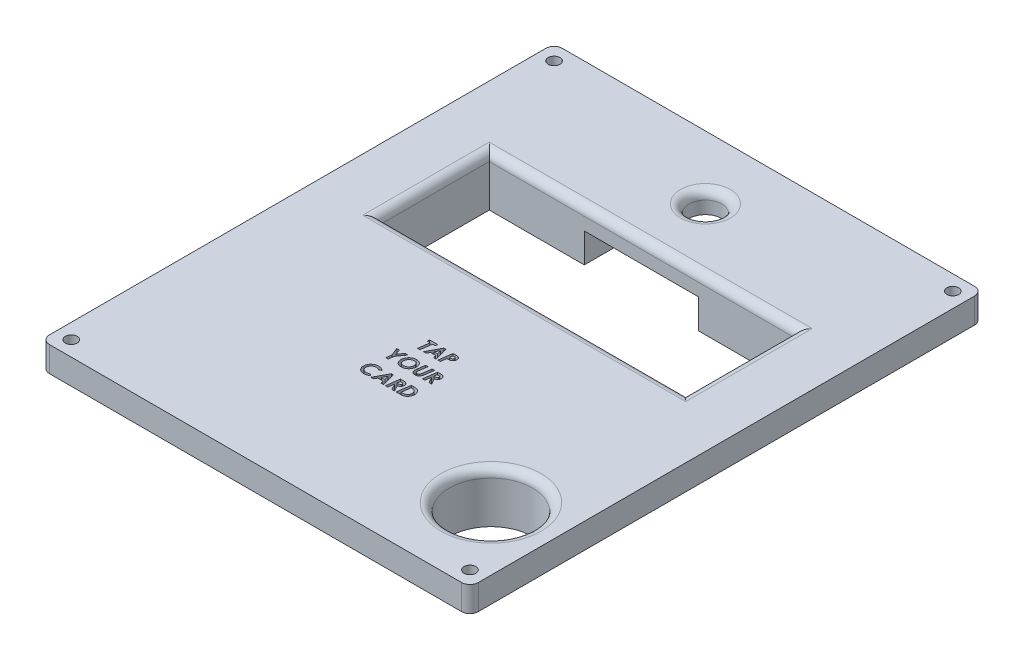
from build123d import *

# Parameters (mm, degrees)
BOSS_EXTRUDE1_DEPTH     = 6
SKETCH3_R               = 1.4
CUT_EXTRUDE1_DEPTH      = 151.691738327
MIRROR2_COPY_1_SKETCH_R = 1.4
MIRROR2_COPY_1_DEPTH    = 151.691738327
BOSS_EXTRUDE2_START     = -12
BOSS_EXTRUDE2_DEPTH     = 12
SKETCH5_R               = 3.9
SKETCH5_W               = 72.8
SKETCH5_H               = 26.1
CUT_EXTRUDE2_DEPTH      = 12
FILLET1_R               = 2
SKETCH6_W               = 39.3
SKETCH6_H               = 59.7
CUT_EXTRUDE3_DEPTH      = 10
CUT_EXTRUDE4_DEPTH      = 2
SKETCH8_R               = 9.9
CUT_EXTRUDE5_DEPTH      = 152.049660848
FILLET2_R               = 2
SKETCH10_W              = 27.2
SKETCH10_H              = 24
CUT_EXTRUDE6_DEPTH      = 7


with BuildPart() as part:
    # Sketch2 → Boss-Extrude1 (new body)
    with BuildSketch(Plane(origin=(0, 0, 0), x_dir=(1, 0, 0), z_dir=(0, 1, 0))):
        with BuildLine():
            Line((-94, 116), (4, 116))
            ThreePointArc((4, 116), (5.414213562, 115.414213562), (6, 114))
            Line((6, 114), (6, -4))
            ThreePointArc((6, -4), (5.414213562, -5.414213562), (4, -6))
            Line((4, -6), (-94, -6))
            ThreePointArc((-94, -6), (-95.414213562, -5.414213562), (-96, -4))
            Line((-96, -4), (-96, 114))
            ThreePointArc((-96, 114), (-95.414213562, 115.414213562), (-94, 116))
        make_face()
        with BuildLine():
            Line((-88, 110), (-2, 110))
            ThreePointArc((-2, 110), (-0.585786438, 109.414213562), (0, 108))
            Line((0, 108), (0, 2))
            ThreePointArc((0, 2), (-0.585786438, 0.585786438), (-2, 0))
            Line((-2, 0), (-88, 0))
            ThreePointArc((-88, 0), (-89.414213562, 0.585786438), (-90, 2))
            Line((-90, 2), (-90, 108))
            ThreePointArc((-90, 108), (-89.414213562, 109.414213562), (-88, 110))
        make_face(mode=Mode.SUBTRACT)
    extrude(amount=BOSS_EXTRUDE1_DEPTH)

    # Sketch3 → Cut-Extrude1 (cut, through all)
    with BuildSketch(Plane(origin=(0, 6, 0), x_dir=(1, 0, 0), z_dir=(0, 1, 0))):
        with Locations(Location((-92.414213562, 112.414213562, 0), (0, 0, 270))):
            Circle(SKETCH3_R)
    cut_extrude1 = extrude(amount=-CUT_EXTRUDE1_DEPTH, mode=Mode.SUBTRACT)

    # Mirror1: Cut-Extrude1 across plane
    add(cut_extrude1.mirror(Plane.ZY.offset(45)), mode=Mode.SUBTRACT)

    # Mirror2: Cut-Extrude1 across plane
    add(cut_extrude1.mirror(Plane.XY.offset(-55)), mode=Mode.SUBTRACT)

    # Mirror2 copy 1 sketch → Mirror2 copy 1 (cut, through all)
    with BuildSketch(Plane(origin=(-90, 6, -110), x_dir=(-1, 0, 0), z_dir=(0, 1, 0))):
        with Locations(Location((-92.414213562, 112.414213562, 0), (0, 0, 270))):
            Circle(MIRROR2_COPY_1_SKETCH_R)
    extrude(amount=-MIRROR2_COPY_1_DEPTH, mode=Mode.SUBTRACT)

    # Sketch4 → Boss-Extrude2 (add)
    with BuildSketch(Plane(origin=(0, 6, 0), x_dir=(1, 0, 0), z_dir=(0, 1, 0)).offset(BOSS_EXTRUDE2_START)):
        with BuildLine():
            Line((-88, 0), (-2, 0))
            ThreePointArc((-2, 0), (-0.585786438, 0.585786438), (0, 2))
            Line((0, 2), (0, 108))
            ThreePointArc((0, 108), (-0.585786438, 109.414213562), (-2, 110))
            Line((-2, 110), (-88, 110))
            ThreePointArc((-88, 110), (-89.414213562, 109.414213562), (-90, 108))
            Line((-90, 108), (-90, 2))
            ThreePointArc((-90, 2), (-89.414213562, 0.585786438), (-88, 0))
        make_face()
    extrude(amount=BOSS_EXTRUDE2_DEPTH)

    # Sketch5 → Cut-Extrude2 (cut)
    with BuildSketch(Plane(origin=(0, 6, 0), x_dir=(1, 0, 0), z_dir=(0, 1, 0))):
        with Locations(Location((-45, 101, 0), (0, 0, 270))):
            Circle(SKETCH5_R)
        with Locations((-45, 72.95)):
            Rectangle(SKETCH5_W, SKETCH5_H)
    extrude(amount=-CUT_EXTRUDE2_DEPTH, mode=Mode.SUBTRACT)

    # Fillet1
    fillet1_edges = [part.edges().sort_by_distance(p)[0] for p in [
        (-81.4, 6, -72.95),
        (-45, 6, -59.9),
        (-8.6, 6, -72.95),
        (-45, 6, -86),
        (-45, 6, -104.9),
    ]]
    fillet(fillet1_edges, radius=FILLET1_R)

    # Sketch6 → Cut-Extrude3 (cut)
    with BuildSketch(Plane.XZ.offset(6)):
        with Locations((-49.6, -25.05)):
            Rectangle(SKETCH6_W, SKETCH6_H)
    extrude(amount=-CUT_EXTRUDE3_DEPTH, mode=Mode.SUBTRACT)

    # Sketch7 → Cut-Extrude4 (cut)
    # profile 1 of 11: a face of its own
    with BuildSketch(Plane(origin=(0, 6, 0), x_dir=(1, 0, 0), z_dir=(0, 1, 0))):
        Polygon((-49.744871795, 40.167830978), (-47.831730769, 40.167830978), (-47.900420673, 39.638664311), (-48.51799379, 39.638664311), (-48.885611979, 36.992830978), (-49.459935897, 36.992830978), (-49.093589744, 39.638664311), (-49.818013822, 39.638664311), align=None)
    # profile 2 of 11: a face of its own
    with BuildSketch(Plane(origin=(0, 6, 0), x_dir=(1, 0, 0), z_dir=(0, 1, 0))):
        Polygon((-46.369526242, 40.167830978), (-45.869616386, 40.167830978), (-45.063782051, 36.992830978), (-45.649554287, 36.992830978), (-45.825095152, 37.684818157), (-47.063421474, 37.684818157), (-47.434855769, 36.992830978), (-48.075961538, 36.992830978), align=None)
        Polygon((-45.960566907, 38.213984824), (-46.221970152, 39.248785505), (-46.779121595, 38.213984824), align=None, mode=Mode.SUBTRACT)
    # profile 3 of 11: a face of its own
    with BuildSketch(Plane(origin=(0, 6, 0), x_dir=(1, 0, 0), z_dir=(0, 1, 0))):
        with BuildLine():
            Line((-44.170813301, 40.167830978), (-43.627654247, 40.167830978))
            add(Edge.make_bspline(
                [(-43.627654247, 40.167830978), (-43.588003731, 40.167669491), (-43.511643271, 40.167358494), (-43.401577566, 40.162696225), (-43.300384916, 40.1559322), (-43.208315119, 40.146459396), (-43.125386587, 40.134927505), (-43.051842161, 40.119271683), (-42.9867555, 40.102579063), (-42.947621545, 40.086806208), (-42.929306891, 40.079424527)],
                knots=[0, 0, 0, 0, 1.344208059, 2.588726621, 3.734329264, 4.782131975, 5.726482068, 6.570895881, 7.331180631, 8, 8, 8, 8], degree=3))
            add(Edge.make_bspline(
                [(-42.929306891, 40.079424527), (-42.908811052, 40.070176556), (-42.868412322, 40.051948158), (-42.811332777, 40.020061667), (-42.758192981, 39.985375635), (-42.708493733, 39.948656416), (-42.662598682, 39.909097892), (-42.620240816, 39.867018474), (-42.582177394, 39.821734815), (-42.547655113, 39.773940292), (-42.51727933, 39.723626424), (-42.490290294, 39.671516983), (-42.468203937, 39.617105571), (-42.449383565, 39.56093108), (-42.435607577, 39.50211203), (-42.425618819, 39.441336652), (-42.418806519, 39.378474335), (-42.418237992, 39.335938259), (-42.417948718, 39.31429532)],
                knots=[0, 0, 0, 0, 1.101151138, 2.170445781, 3.198860437, 4.208379212, 5.195204417, 6.164605257, 7.130047863, 8.089887807, 9.049952485, 10.006809717, 10.961522665, 11.923831799, 12.906274987, 13.917075149, 14.940179313, 16, 16, 16, 16], degree=3))
            add(Edge.make_bspline(
                [(-42.417948718, 39.31429532), (-42.418492495, 39.290535582), (-42.41957266, 39.243338941), (-42.426519046, 39.173576447), (-42.438659602, 39.10552824), (-42.456102364, 39.039333232), (-42.477423521, 38.97429861), (-42.504462941, 38.911350336), (-42.535501097, 38.849902122), (-42.57198103, 38.791156201), (-42.611468492, 38.734543971), (-42.655714869, 38.682353231), (-42.702866342, 38.634117297), (-42.752674256, 38.588780239), (-42.806817285, 38.548688545), (-42.863398049, 38.511321495), (-42.92375898, 38.478892582), (-42.98817048, 38.449671569), (-43.060103954, 38.424476957), (-43.141321185, 38.402578531), (-43.233503406, 38.383576494), (-43.336284207, 38.368057196), (-43.450005144, 38.355342806), (-43.574347926, 38.346299588), (-43.709625681, 38.338982588), (-43.803396961, 38.337086424), (-43.85216847, 38.336100208)],
                knots=[0, 0, 0, 0, 0.866399648, 1.721027061, 2.553550129, 3.384204618, 4.21539855, 5.04677222, 5.880012857, 6.723270778, 7.566245156, 8.394738354, 9.214784533, 10.025005932, 10.847562629, 11.668810448, 12.495570546, 13.343317016, 14.245569203, 15.271435576, 16.408570332, 17.675782105, 19.060520395, 20.580184572, 22.221315141, 24, 24, 24, 24], degree=3))
            Line((-43.85216847, 38.336100208), (-44.041065705, 36.992830978))
            Line((-44.041065705, 36.992830978), (-44.616025641, 36.992830978))
            Line((-44.616025641, 36.992830978), (-44.170813301, 40.167830978))
        make_face()
        with BuildLine():
            add(Edge.make_bspline(
                [(-43.779026442, 38.865266875), (-43.739802006, 38.865936707), (-43.664925512, 38.867215365), (-43.557955927, 38.871827253), (-43.461831998, 38.880723593), (-43.376230756, 38.89255532), (-43.301180944, 38.907563679), (-43.23636571, 38.925406542), (-43.182653026, 38.947615082), (-43.138184739, 38.972661293), (-43.102896166, 39.002480711), (-43.071620081, 39.033740275), (-43.045468348, 39.06885978), (-43.024454299, 39.107523709), (-43.007647809, 39.149063358), (-42.996412839, 39.194244166), (-42.989345201, 39.242414658), (-42.988335836, 39.27568487), (-42.987820513, 39.292670721)],
                knots=[0, 0, 0, 0, 1.838765686, 3.510065221, 5.016980247, 6.361850363, 7.558417778, 8.602601797, 9.506864385, 10.2772185, 10.983371583, 11.664976924, 12.346654695, 13.027100102, 13.722757683, 14.440973152, 15.204050804, 16, 16, 16, 16], degree=3))
            add(Edge.make_bspline(
                [(-42.987820513, 39.292670721), (-42.988592238, 39.311581901), (-42.990096939, 39.348454707), (-43.000602832, 39.401468676), (-43.019738466, 39.449545831), (-43.044913924, 39.493144809), (-43.077999739, 39.531221521), (-43.117960592, 39.563451226), (-43.165213728, 39.588996015), (-43.210161851, 39.604740972), (-43.251923706, 39.614790825), (-43.291101841, 39.620742948), (-43.337098335, 39.626555841), (-43.390175289, 39.630660966), (-43.449947457, 39.634654903), (-43.51696927, 39.637073476), (-43.590973441, 39.638156591), (-43.642706344, 39.638490516), (-43.66963141, 39.638664311)],
                knots=[0, 0, 0, 0, 1.03742853, 2.022766538, 2.947121861, 3.864647693, 4.771646501, 5.697975149, 6.666071958, 7.703435297, 8.301453266, 9.020359131, 9.87578453, 10.844509861, 11.939964187, 13.162010635, 14.522931311, 16, 16, 16, 16], degree=3))
            Line((-43.66963141, 39.638664311), (-43.779026442, 38.865266875))
        make_face(mode=Mode.SUBTRACT)
    # profile 4 of 11: a face of its own
    with BuildSketch(Plane(origin=(0, 6, 0), x_dir=(1, 0, 0), z_dir=(0, 1, 0))):
        Polygon((-51.881891026, 34.47643421), (-51.275130208, 34.47643421), (-50.789848758, 33.221571429), (-49.886703726, 34.47643421), (-49.197896635, 34.47643421), (-50.571058694, 32.56710929), (-50.737695313, 31.30143421), (-51.312019231, 31.30143421), (-51.144746595, 32.570289378), align=None)
    # profile 5 of 11: a face of its own
    with BuildSketch(Plane(origin=(0, 6, 0), x_dir=(1, 0, 0), z_dir=(0, 1, 0))):
        with BuildLine():
            add(Edge.make_bspline(
                [(-47.244686498, 34.557844466), (-47.191196979, 34.556721875), (-47.086171897, 34.554517702), (-46.932227555, 34.534233966), (-46.785361577, 34.501540777), (-46.645931798, 34.454659521), (-46.513402874, 34.395433309), (-46.388093707, 34.32244456), (-46.270141125, 34.236208422), (-46.160505538, 34.137893369), (-46.061196568, 34.029567841), (-45.973130411, 33.913625721), (-45.899992421, 33.789539635), (-45.839761282, 33.658691319), (-45.792281391, 33.520937702), (-45.759893277, 33.375616805), (-45.73851455, 33.223691534), (-45.736461961, 33.119883865), (-45.735416667, 33.067019146)],
                knots=[0, 0, 0, 0, 1.079937363, 2.120424901, 3.130164457, 4.114608815, 5.086352068, 6.057283592, 7.037967613, 8.032612779, 9.026667848, 10.002130715, 10.967845321, 11.92966918, 12.907375778, 13.904589319, 14.932898699, 16, 16, 16, 16], degree=3))
            add(Edge.make_bspline(
                [(-45.735416667, 33.067019146), (-45.73608611, 33.025859156), (-45.73741758, 32.943995127), (-45.75008715, 32.822271597), (-45.769824627, 32.70227551), (-45.796849929, 32.583972233), (-45.833025979, 32.467741203), (-45.876208608, 32.352893762), (-45.927723864, 32.239899797), (-45.986886361, 32.129634513), (-46.05169752, 32.023396747), (-46.122734518, 31.922941061), (-46.19904989, 31.828863643), (-46.280350747, 31.740794117), (-46.367514976, 31.659911505), (-46.458838916, 31.584521381), (-46.556300939, 31.516337379), (-46.658353836, 31.45405691), (-46.765210895, 31.39870617), (-46.876150059, 31.350866074), (-46.991026942, 31.310867384), (-47.109570295, 31.277798917), (-47.232072916, 31.251490989), (-47.358512122, 31.233317473), (-47.488932268, 31.222288157), (-47.57708995, 31.220786367), (-47.621844952, 31.220023953)],
                knots=[0, 0, 0, 0, 1.005311864, 1.999487392, 2.986390894, 3.975195422, 4.961487101, 5.958115224, 6.97104375, 7.992937587, 9.013623077, 10.009524137, 10.996414046, 11.971324635, 12.935123389, 13.899409138, 14.862205298, 15.838449601, 16.81836937, 17.799766407, 18.787539403, 19.787875373, 20.804768927, 21.846385261, 22.906674593, 24, 24, 24, 24], degree=3))
            add(Edge.make_bspline(
                [(-47.621844952, 31.220023953), (-47.677239204, 31.22116552), (-47.785402904, 31.223394563), (-47.943044096, 31.243081381), (-48.092195911, 31.273819296), (-48.232865224, 31.317822927), (-48.365314087, 31.374564887), (-48.489105416, 31.444189465), (-48.604542317, 31.52593755), (-48.709689641, 31.620388584), (-48.805300712, 31.723992505), (-48.887402827, 31.837610786), (-48.958302843, 31.958176047), (-49.014551897, 32.087663828), (-49.059561116, 32.224485132), (-49.090919684, 32.369427024), (-49.110530038, 32.52226143), (-49.112787604, 32.626833637), (-49.113942308, 32.680320428)],
                knots=[0, 0, 0, 0, 1.129126937, 2.20475128, 3.23403939, 4.230775744, 5.204839333, 6.16680792, 7.121629951, 8.083044708, 9.04383724, 9.990659777, 10.936010704, 11.890255174, 12.863608629, 13.868449271, 14.909750384, 16, 16, 16, 16], degree=3))
            add(Edge.make_bspline(
                [(-49.113942308, 32.680320428), (-49.112555013, 32.741458342), (-49.109823355, 32.861842165), (-49.085810573, 33.039045807), (-49.049106391, 33.210095252), (-48.995024519, 33.374081643), (-48.926819765, 33.531627242), (-48.842813448, 33.682207503), (-48.744307202, 33.827043464), (-48.667508954, 33.91617373), (-48.628660857, 33.961259931)],
                knots=[0, 0, 0, 0, 1.045740506, 2.05911896, 3.05467723, 4.035585325, 5.008815224, 5.988058098, 6.982266978, 8, 8, 8, 8], degree=3))
            add(Edge.make_bspline(
                [(-48.628660857, 33.961259931), (-48.606046182, 33.985705352), (-48.561224003, 34.034156061), (-48.489488885, 34.10148706), (-48.415997743, 34.16452525), (-48.339710326, 34.222522289), (-48.261778799, 34.276825204), (-48.180961323, 34.325722499), (-48.097563609, 34.369744769), (-48.012492688, 34.409887349), (-47.924284817, 34.444162991), (-47.834464712, 34.474873987), (-47.741785886, 34.500213426), (-47.646901524, 34.521186358), (-47.549720798, 34.537862595), (-47.450114594, 34.549054459), (-47.348252367, 34.556297115), (-47.279467901, 34.557324806), (-47.244686498, 34.557844466)],
                knots=[0, 0, 0, 0, 1.027812829, 2.037120149, 3.035266778, 4.015768311, 4.994345575, 5.966422343, 6.929711672, 7.904780536, 8.86860337, 9.849672715, 10.834163809, 11.833018336, 12.848777673, 13.876590502, 14.926281379, 16, 16, 16, 16], degree=3))
        make_face()
        with BuildLine():
            add(Edge.make_bspline(
                [(-47.258042869, 34.028677799), (-47.286896372, 34.028246445), (-47.344300191, 34.027388268), (-47.429264569, 34.018758039), (-47.512519674, 34.005386229), (-47.593715694, 33.987060934), (-47.673242188, 33.963410157), (-47.750557711, 33.934182291), (-47.826233504, 33.899592248), (-47.89943525, 33.859678997), (-47.970408513, 33.815170174), (-48.037671268, 33.765497608), (-48.101696498, 33.711372383), (-48.161406544, 33.651840232), (-48.218112604, 33.588124384), (-48.27165594, 33.520096146), (-48.321367812, 33.447092948), (-48.36746933, 33.370329119), (-48.408392792, 33.290434225), (-48.444741926, 33.209866332), (-48.475677396, 33.128613971), (-48.500211059, 33.046456219), (-48.520238702, 32.963722429), (-48.534126033, 32.880194623), (-48.542748675, 32.79604772), (-48.543629434, 32.739702565), (-48.544070513, 32.711485291)],
                knots=[0, 0, 0, 0, 1.015557909, 2.02044445, 3.003357477, 3.982977463, 4.948851735, 5.922052592, 6.890662853, 7.875953625, 8.855459861, 9.837777552, 10.817397539, 11.804383193, 12.803598646, 13.818964529, 14.849984807, 15.911175445, 16.969421976, 18.008462528, 19.021851172, 20.027762868, 21.025304218, 22.016795393, 23.006824523, 24, 24, 24, 24], degree=3))
            add(Edge.make_bspline(
                [(-48.544070513, 32.711485291), (-48.543374171, 32.678587178), (-48.54200408, 32.613858339), (-48.530065338, 32.518573525), (-48.511567419, 32.426837155), (-48.483576051, 32.339409534), (-48.449564044, 32.255345375), (-48.406380436, 32.17590108), (-48.356738683, 32.099505776), (-48.299042587, 32.028100003), (-48.23459929, 31.962173323), (-48.161896082, 31.905295646), (-48.082782872, 31.856729013), (-47.996919879, 31.817208663), (-47.904377848, 31.786363113), (-47.804918806, 31.765402914), (-47.698980394, 31.751513452), (-47.626131459, 31.749978035), (-47.588772035, 31.74919062)],
                knots=[0, 0, 0, 0, 1.032572517, 2.031642993, 3.01079972, 3.966643664, 4.909863955, 5.853952978, 6.801111379, 7.766917104, 8.731873648, 9.689385086, 10.65752794, 11.640388645, 12.650815691, 13.713650281, 14.827481725, 16, 16, 16, 16], degree=3))
            add(Edge.make_bspline(
                [(-47.588772035, 31.74919062), (-47.545039536, 31.750223897), (-47.458685115, 31.752264211), (-47.331845611, 31.770436659), (-47.210085475, 31.800603636), (-47.093394254, 31.84182719), (-46.981734357, 31.895182915), (-46.875103014, 31.960302469), (-46.773775358, 32.037807054), (-46.678566499, 32.125669408), (-46.591105771, 32.221568716), (-46.514653299, 32.324059714), (-46.449726867, 32.431793034), (-46.396829312, 32.544533095), (-46.355900663, 32.66246966), (-46.3267241, 32.785395522), (-46.308311971, 32.913393261), (-46.306304847, 33.000598651), (-46.305288462, 33.044758529)],
                knots=[0, 0, 0, 0, 1.03369803, 2.041145535, 3.022357397, 3.995919545, 4.96236968, 5.943376615, 6.945032455, 7.973917545, 9.003120129, 10.009769043, 10.992465341, 11.972511115, 12.949140339, 13.93890809, 14.956285095, 16, 16, 16, 16], degree=3))
            add(Edge.make_bspline(
                [(-46.305288462, 33.044758529), (-46.305874813, 33.081053561), (-46.30702393, 33.152183634), (-46.320292031, 33.255760509), (-46.34044674, 33.353933533), (-46.368778918, 33.446672364), (-46.406940193, 33.533455263), (-46.451710004, 33.615350517), (-46.50592969, 33.690968752), (-46.567372534, 33.760559978), (-46.635302763, 33.82379367), (-46.709398367, 33.878314277), (-46.788048145, 33.925651199), (-46.872597241, 33.962581305), (-46.961515751, 33.993212477), (-47.055851733, 34.013805984), (-47.155324279, 34.025967478), (-47.223238699, 34.02775946), (-47.258042869, 34.028677799)],
                knots=[0, 0, 0, 0, 1.12845219, 2.211511647, 3.242392028, 4.243671568, 5.221368115, 6.186708094, 7.141970352, 8.109200861, 9.070590294, 10.022934043, 10.966237583, 11.91979086, 12.887493425, 13.887534174, 14.917422563, 16, 16, 16, 16], degree=3))
        make_face(mode=Mode.SUBTRACT)
    # profile 6 of 11: a face of its own
    with BuildSketch(Plane(origin=(0, 6, 0), x_dir=(1, 0, 0), z_dir=(0, 1, 0))):
        with BuildLine():
            Line((-45.004632412, 34.47643421), (-44.428400441, 34.47643421))
            Line((-44.428400441, 34.47643421), (-44.703796074, 32.512411774))
            add(Edge.make_bspline(
                [(-44.703796074, 32.512411774), (-44.706596873, 32.491216889), (-44.711971105, 32.450547694), (-44.719007147, 32.391822494), (-44.724772811, 32.337971593), (-44.729119644, 32.288964672), (-44.732857523, 32.244864924), (-44.736529263, 32.205695156), (-44.737514829, 32.171086436), (-44.737942199, 32.14966936), (-44.738141026, 32.139705444)],
                knots=[0, 0, 0, 0, 1.370131483, 2.629037392, 3.790386942, 4.840899086, 5.781938864, 6.627066857, 7.36126714, 8, 8, 8, 8], degree=3))
            add(Edge.make_bspline(
                [(-44.738141026, 32.139705444), (-44.736926513, 32.110529019), (-44.734603717, 32.054728155), (-44.71341435, 31.975763733), (-44.676993544, 31.907504597), (-44.627019426, 31.849355016), (-44.56285635, 31.803700186), (-44.485385481, 31.772041022), (-44.395906974, 31.752058977), (-44.331842911, 31.750181785), (-44.298016827, 31.74919062)],
                knots=[0, 0, 0, 0, 1.045914474, 2.000345514, 2.905926209, 3.80150764, 4.72860727, 5.703865586, 6.787631738, 8, 8, 8, 8], degree=3))
            add(Edge.make_bspline(
                [(-44.298016827, 31.74919062), (-44.269961015, 31.750161326), (-44.2151493, 31.752057762), (-44.136035406, 31.767004768), (-44.062074355, 31.790828756), (-44.017436572, 31.814854963), (-43.995272436, 31.826784771)],
                knots=[0, 0, 0, 0, 1.064247791, 2.079185811, 3.046252183, 4, 4, 4, 4], degree=3))
            add(Edge.make_bspline(
                [(-43.995272436, 31.826784771), (-43.979603394, 31.837518516), (-43.947573861, 31.859459669), (-43.905764129, 31.903260093), (-43.869816266, 31.956649965), (-43.843742965, 32.008432477), (-43.824805476, 32.057416133), (-43.810201622, 32.103248222), (-43.796777812, 32.157609321), (-43.78173327, 32.219768815), (-43.768309757, 32.290342835), (-43.753895279, 32.368900004), (-43.741095055, 32.455991726), (-43.732170996, 32.516864488), (-43.727509014, 32.548664779)],
                knots=[0, 0, 0, 0, 0.859785812, 1.75751252, 2.725816041, 3.770921983, 4.379908327, 5.106796295, 5.951169398, 6.919234109, 8.007475297, 9.209126838, 10.542031388, 12, 12, 12, 12], degree=3))
            Line((-43.727509014, 32.548664779), (-43.458473558, 34.47643421))
            Line((-43.458473558, 34.47643421), (-42.882877604, 34.47643421))
            Line((-42.882877604, 34.47643421), (-43.148096955, 32.577285572))
            add(Edge.make_bspline(
                [(-43.148096955, 32.577285572), (-43.154632656, 32.530394586), (-43.167283984, 32.439626462), (-43.189609775, 32.309029926), (-43.212999077, 32.188756251), (-43.237613547, 32.078772293), (-43.264351809, 31.979118262), (-43.291776784, 31.889282706), (-43.321777122, 31.810154068), (-43.353151554, 31.740102521), (-43.387611137, 31.677429631), (-43.424496188, 31.619224324), (-43.46503423, 31.56492109), (-43.510379535, 31.515374735), (-43.557515254, 31.467900731), (-43.609533034, 31.425268602), (-43.664892535, 31.38648715), (-43.723602696, 31.35151097), (-43.785440576, 31.31994682), (-43.851022342, 31.29376169), (-43.919420061, 31.270316946), (-43.99142663, 31.252334718), (-44.066520434, 31.237418037), (-44.145170247, 31.22761266), (-44.226877531, 31.220902848), (-44.282526184, 31.22031962), (-44.310737179, 31.220023953)],
                knots=[0, 0, 0, 0, 1.68937953, 3.270176719, 4.727170616, 6.061442758, 7.290970074, 8.408416811, 9.411646792, 10.308867284, 11.145104278, 11.961496883, 12.766452085, 13.559335946, 14.356431464, 15.151693874, 15.955546226, 16.76645207, 17.588608135, 18.430132747, 19.284214091, 20.166802823, 21.07631458, 22.014693117, 22.993551838, 24, 24, 24, 24], degree=3))
            add(Edge.make_bspline(
                [(-44.310737179, 31.220023953), (-44.348721112, 31.220660692), (-44.422772643, 31.221902045), (-44.530390828, 31.234299992), (-44.63166764, 31.25393006), (-44.7265305, 31.281027375), (-44.815263869, 31.316215294), (-44.897423215, 31.359408056), (-44.973239457, 31.410707478), (-45.042012932, 31.469809413), (-45.102741464, 31.536291898), (-45.157161513, 31.607609804), (-45.201434274, 31.68608957), (-45.238495213, 31.769515859), (-45.267401221, 31.858818475), (-45.287177766, 31.953938401), (-45.300608093, 32.054733722), (-45.301719565, 32.123971005), (-45.302288662, 32.15942199)],
                knots=[0, 0, 0, 0, 1.176817036, 2.294262238, 3.35222762, 4.371216899, 5.347337327, 6.305512179, 7.242247007, 8.178728305, 9.108709636, 10.028608558, 10.952815287, 11.894170772, 12.854168769, 13.85552807, 14.901984008, 16, 16, 16, 16], degree=3))
            add(Edge.make_bspline(
                [(-45.302288662, 32.15942199), (-45.30220213, 32.17617383), (-45.302019117, 32.211603719), (-45.299077697, 32.26735698), (-45.295419221, 32.328868985), (-45.289655304, 32.395879366), (-45.281794641, 32.468558061), (-45.272873267, 32.546787241), (-45.26287505, 32.630795349), (-45.254895788, 32.688601138), (-45.250771234, 32.718481485)],
                knots=[0, 0, 0, 0, 0.71553134, 1.513337966, 2.384471215, 3.347928436, 4.386088841, 5.507247356, 6.711473103, 8, 8, 8, 8], degree=3))
            Line((-45.250771234, 32.718481485), (-45.004632412, 34.47643421))
        make_face()
    # profile 7 of 11: a face of its own
    with BuildSketch(Plane(origin=(0, 6, 0), x_dir=(1, 0, 0), z_dir=(0, 1, 0))):
        with BuildLine():
            Line((-42.155909455, 34.47643421), (-41.604482171, 34.47643421))
            add(Edge.make_bspline(
                [(-41.604482171, 34.47643421), (-41.563560306, 34.47626698), (-41.484658029, 34.47594454), (-41.371193989, 34.471359453), (-41.267053302, 34.46444197), (-41.172359798, 34.45531298), (-41.087034416, 34.442647018), (-41.011254597, 34.427438992), (-40.944536317, 34.410502737), (-40.9045256, 34.394764464), (-40.885782252, 34.387391742)],
                knots=[0, 0, 0, 0, 1.348808202, 2.600664361, 3.742342956, 4.788858012, 5.735658768, 6.584006912, 7.336666444, 8, 8, 8, 8], degree=3))
            add(Edge.make_bspline(
                [(-40.885782252, 34.387391742), (-40.864679652, 34.377875477), (-40.823427409, 34.359272687), (-40.76431535, 34.327739814), (-40.708961508, 34.293770353), (-40.658283273, 34.256083543), (-40.611211177, 34.216266254), (-40.568037111, 34.173939771), (-40.529108716, 34.128454514), (-40.494017446, 34.08062632), (-40.462814441, 34.030517049), (-40.436029875, 33.977879599), (-40.412869725, 33.92315961), (-40.394783568, 33.865761635), (-40.379751797, 33.806374671), (-40.370029793, 33.744624028), (-40.363187905, 33.680718), (-40.362625712, 33.63733416), (-40.362339744, 33.615266341)],
                knots=[0, 0, 0, 0, 1.116361014, 2.182309107, 3.229450697, 4.24598407, 5.225421932, 6.201651319, 7.158895679, 8.110002388, 9.060669178, 10.002827475, 10.956240434, 11.923213192, 12.902917952, 13.908279153, 14.936015885, 16, 16, 16, 16], degree=3))
            add(Edge.make_bspline(
                [(-40.362339744, 33.615266341), (-40.363012268, 33.588110371), (-40.364339941, 33.53450009), (-40.373015234, 33.455444519), (-40.389195734, 33.379582491), (-40.410985987, 33.306675034), (-40.437982361, 33.236250081), (-40.472797718, 33.169533078), (-40.513039941, 33.105361562), (-40.559515601, 33.044576865), (-40.611463341, 32.986621385), (-40.671444781, 32.934905867), (-40.736141662, 32.885952295), (-40.808211823, 32.843042792), (-40.885673157, 32.803183684), (-40.970292447, 32.769412626), (-41.060481522, 32.738247151), (-41.123720457, 32.722649265), (-41.156089744, 32.71466538)],
                knots=[0, 0, 0, 0, 0.995453645, 1.965186658, 2.910129054, 3.83459069, 4.752398018, 5.669942118, 6.588407184, 7.525617038, 8.471772905, 9.435289717, 10.423772802, 11.441988612, 12.505459691, 13.613754905, 14.778583949, 16, 16, 16, 16], degree=3))
            Line((-41.156089744, 32.71466538), (-40.423397436, 31.30143421))
            Line((-40.423397436, 31.30143421), (-41.060051082, 31.30143421))
            Line((-41.060051082, 31.30143421), (-41.777478966, 32.685408569))
            Line((-41.777478966, 32.685408569), (-41.830904447, 32.685408569))
            Line((-41.830904447, 32.685408569), (-42.026161859, 31.30143421))
            Line((-42.026161859, 31.30143421), (-42.601121795, 31.30143421))
            Line((-42.601121795, 31.30143421), (-42.155909455, 34.47643421))
        make_face()
        with BuildLine():
            add(Edge.make_bspline(
                [(-41.756490385, 33.214575235), (-41.715567143, 33.214954077), (-41.637291277, 33.215678705), (-41.525500155, 33.22074926), (-41.424892208, 33.228670266), (-41.335579467, 33.240194676), (-41.257280767, 33.25362843), (-41.190149173, 33.270484449), (-41.134079143, 33.290517557), (-41.088187434, 33.3142766), (-41.051011954, 33.342171657), (-41.018834986, 33.371940135), (-40.99204187, 33.405262629), (-40.969935149, 33.441579749), (-40.952884963, 33.480966763), (-40.940589143, 33.523690514), (-40.933790686, 33.569466136), (-40.932745569, 33.601040585), (-40.932211538, 33.617174394)],
                knots=[0, 0, 0, 0, 1.89335902, 3.621519463, 5.176573087, 6.561132097, 7.786781855, 8.850229336, 9.759505088, 10.53614971, 11.230649399, 11.903761734, 12.55942339, 13.202041648, 13.865362736, 14.539046595, 15.253486819, 16, 16, 16, 16], degree=3))
            add(Edge.make_bspline(
                [(-40.932211538, 33.617174394), (-40.93290282, 33.635467803), (-40.934243812, 33.670954508), (-40.945842843, 33.722065605), (-40.96567679, 33.768430285), (-40.993550684, 33.809605407), (-41.028335864, 33.845911227), (-41.070771648, 33.87581467), (-41.120374235, 33.899348783), (-41.166836881, 33.914916799), (-41.210619241, 33.923841646), (-41.25159084, 33.930085053), (-41.300158323, 33.935739601), (-41.356380083, 33.940113849), (-41.420020531, 33.942995891), (-41.491249698, 33.945751852), (-41.570134923, 33.946742499), (-41.625258889, 33.947087231), (-41.654091546, 33.947267543)],
                knots=[0, 0, 0, 0, 0.975025327, 1.891415476, 2.778007847, 3.650053007, 4.529910843, 5.446300992, 6.402314795, 7.450247022, 8.051382379, 8.78400578, 9.660805258, 10.659230114, 11.791644133, 13.059173022, 14.461796856, 16, 16, 16, 16], degree=3))
            Line((-41.654091546, 33.947267543), (-41.756490385, 33.214575235))
        make_face(mode=Mode.SUBTRACT)
    # profile 8 of 11: a face of its own
    with BuildSketch(Plane(origin=(0, 6, 0), x_dir=(1, 0, 0), z_dir=(0, 1, 0))):
        with BuildLine():
            Line((-49.168639824, 28.239685121), (-49.608128005, 27.845990209))
            add(Edge.make_bspline(
                [(-49.608128005, 27.845990209), (-49.632517126, 27.872712556), (-49.681199479, 27.926052189), (-49.765552068, 27.99454867), (-49.85694532, 28.054168022), (-49.955794001, 28.103664866), (-50.060601729, 28.143197835), (-50.170468877, 28.171054051), (-50.284743216, 28.188060584), (-50.362385682, 28.190239493), (-50.401878005, 28.191347781)],
                knots=[0, 0, 0, 0, 0.971056601, 1.938295404, 2.910103745, 3.898650509, 4.902833105, 5.914277838, 6.939111328, 8, 8, 8, 8], degree=3))
            add(Edge.make_bspline(
                [(-50.401878005, 28.191347781), (-50.429882967, 28.190908964), (-50.485593417, 28.190036023), (-50.568695727, 28.18145018), (-50.650854893, 28.167341941), (-50.732204699, 28.14824734), (-50.812941216, 28.124223699), (-50.892182236, 28.09341422), (-50.97066619, 28.057581546), (-51.048026155, 28.017286565), (-51.122368793, 27.971682134), (-51.193132923, 27.922697551), (-51.259640616, 27.87049545), (-51.32155307, 27.814232698), (-51.379259635, 27.754298711), (-51.433807073, 27.691624923), (-51.482473232, 27.624266628), (-51.527805052, 27.554719692), (-51.567642905, 27.48228177), (-51.602458526, 27.408504725), (-51.63319782, 27.333914926), (-51.655873386, 27.257347772), (-51.675787609, 27.180103138), (-51.68855588, 27.101324143), (-51.697474491, 27.02149251), (-51.698301947, 26.967887107), (-51.698717949, 26.940937124)],
                knots=[0, 0, 0, 0, 1.01063672, 2.010466049, 3.011934156, 4.018040672, 5.025194429, 6.049901815, 7.084166442, 8.138480354, 9.196343408, 10.230183256, 11.243713301, 12.245999792, 13.247233952, 14.245803109, 15.242258641, 16.244194478, 17.240973215, 18.223430354, 19.188354289, 20.149355445, 21.103383867, 22.065846529, 23.027609163, 24, 24, 24, 24], degree=3))
            add(Edge.make_bspline(
                [(-51.698717949, 26.940937124), (-51.698016665, 26.904838632), (-51.696636887, 26.833814778), (-51.681152306, 26.729762555), (-51.658105176, 26.630127689), (-51.624747633, 26.535242039), (-51.581727548, 26.445314082), (-51.530328672, 26.359280637), (-51.4677864, 26.279209433), (-51.397734491, 26.203622845), (-51.319773592, 26.135465281), (-51.236224749, 26.074958386), (-51.146555929, 26.024835783), (-51.051959596, 25.982949751), (-50.951587296, 25.951404348), (-50.846212928, 25.928634163), (-50.735556259, 25.91409023), (-50.659935465, 25.912614492), (-50.621304087, 25.911860602)],
                knots=[0, 0, 0, 0, 1.037508871, 2.041300697, 3.018951676, 3.975513831, 4.927438979, 5.88223082, 6.851861871, 7.844178858, 8.842305637, 9.825493826, 10.805727671, 11.791408773, 12.796144752, 13.825955475, 14.88937509, 16, 16, 16, 16], degree=3))
            add(Edge.make_bspline(
                [(-50.621304087, 25.911860602), (-50.579724233, 25.912570117), (-50.497886955, 25.913966583), (-50.377395735, 25.925692071), (-50.261154722, 25.944728648), (-50.149247408, 25.97119963), (-50.041562058, 26.005982332), (-49.938071851, 26.047664742), (-49.838653929, 26.097380486), (-49.776165607, 26.136500354), (-49.744871795, 26.156091371)],
                knots=[0, 0, 0, 0, 1.080949117, 2.127519159, 3.144326023, 4.141762213, 5.114520833, 6.083915527, 7.040435296, 8, 8, 8, 8], degree=3))
            Line((-49.744871795, 26.156091371), (-49.388065905, 25.763032477))
            add(Edge.make_bspline(
                [(-49.388065905, 25.763032477), (-49.433608269, 25.732602895), (-49.524443392, 25.671910506), (-49.668558229, 25.594503915), (-49.818077129, 25.529526895), (-49.972453497, 25.476000945), (-50.132051897, 25.433691018), (-50.297106899, 25.404125262), (-50.467603207, 25.385713802), (-50.583095771, 25.38370998), (-50.641656651, 25.382693935)],
                knots=[0, 0, 0, 0, 0.987115275, 1.968820479, 2.944554184, 3.923725951, 4.912076401, 5.918257257, 6.944445583, 8, 8, 8, 8], degree=3))
            add(Edge.make_bspline(
                [(-50.641656651, 25.382693935), (-50.682591005, 25.383326662), (-50.763073371, 25.384570688), (-50.881315621, 25.393701403), (-50.994998385, 25.407988543), (-51.103902836, 25.429152441), (-51.208241551, 25.455707019), (-51.308039149, 25.488076712), (-51.402901048, 25.527102212), (-51.493398816, 25.571419236), (-51.579049619, 25.622176644), (-51.660640343, 25.678019711), (-51.737560575, 25.739951926), (-51.810457447, 25.80687518), (-51.878657367, 25.879614234), (-51.942334241, 25.958249184), (-52.002050268, 26.042136705), (-52.057223332, 26.130840083), (-52.106762631, 26.223466383), (-52.149689547, 26.318796121), (-52.1872897, 26.415531874), (-52.216055393, 26.514917737), (-52.239999419, 26.615639092), (-52.256247375, 26.718768784), (-52.266948037, 26.823469978), (-52.268041084, 26.894057237), (-52.268589744, 26.929488807)],
                knots=[0, 0, 0, 0, 1.169367826, 2.299132101, 3.38621766, 4.441052208, 5.466435492, 6.460518735, 7.435693363, 8.394593391, 9.33676259, 10.277587488, 11.216890426, 12.155626877, 13.10261201, 14.062754619, 15.044266364, 16.042621295, 17.045211417, 18.042739217, 19.028130471, 20.007415779, 20.996189116, 21.983978755, 22.988049715, 24, 24, 24, 24], degree=3))
            add(Edge.make_bspline(
                [(-52.268589744, 26.929488807), (-52.26792283, 26.967684475), (-52.266593035, 27.043844897), (-52.253768602, 27.157495548), (-52.234367779, 27.269949833), (-52.206594825, 27.381202802), (-52.171996427, 27.491296289), (-52.128038093, 27.599762347), (-52.077404807, 27.707520732), (-52.018148219, 27.812953017), (-51.953478865, 27.915606845), (-51.88170229, 28.012663893), (-51.804574049, 28.104201302), (-51.722780266, 28.191080471), (-51.634540588, 28.271373414), (-51.540669005, 28.345917455), (-51.44151284, 28.415229838), (-51.337226272, 28.478751021), (-51.229269052, 28.535849547), (-51.117912838, 28.584799059), (-51.004448342, 28.627154012), (-50.888417279, 28.66141147), (-50.769752887, 28.68745993), (-50.648938202, 28.706577259), (-50.525498792, 28.718334211), (-50.442396509, 28.719784916), (-50.40060597, 28.720514448)],
                knots=[0, 0, 0, 0, 0.95794203, 1.910092795, 2.865876462, 3.819215003, 4.78477586, 5.758651491, 6.753180615, 7.769892659, 8.790977917, 9.795230985, 10.79565955, 11.792688852, 12.786634645, 13.785945562, 14.798181656, 15.819862441, 16.847685968, 17.859754353, 18.869513914, 19.884373831, 20.892254455, 21.915374149, 22.951681752, 24, 24, 24, 24], degree=3))
            add(Edge.make_bspline(
                [(-50.40060597, 28.720514448), (-50.342234129, 28.719029243), (-50.226968277, 28.716096434), (-50.057210653, 28.693372659), (-49.89337816, 28.655916976), (-49.735693129, 28.602668258), (-49.583576026, 28.535251406), (-49.438035195, 28.451908178), (-49.298456694, 28.353757189), (-49.212282406, 28.278034525), (-49.168639824, 28.239685121)],
                knots=[0, 0, 0, 0, 1.033545388, 2.040923972, 3.027343848, 4.005734438, 4.983995331, 5.969464303, 6.971644303, 8, 8, 8, 8], degree=3))
        make_face()
    # profile 9 of 11: a face of its own
    with BuildSketch(Plane(origin=(0, 6, 0), x_dir=(1, 0, 0), z_dir=(0, 1, 0))):
        Polygon((-47.346449319, 28.639104191), (-46.846539463, 28.639104191), (-46.040705128, 25.464104191), (-46.626477364, 25.464104191), (-46.802018229, 26.156091371), (-48.040344551, 26.156091371), (-48.411778846, 25.464104191), (-49.052884615, 25.464104191), align=None)
        Polygon((-46.937489984, 26.685258038), (-47.198893229, 27.720058719), (-47.756044671, 26.685258038), align=None, mode=Mode.SUBTRACT)
    # profile 10 of 11: a face of its own
    with BuildSketch(Plane(origin=(0, 6, 0), x_dir=(1, 0, 0), z_dir=(0, 1, 0))):
        with BuildLine():
            Line((-45.147736378, 28.639104191), (-44.596309095, 28.639104191))
            add(Edge.make_bspline(
                [(-44.596309095, 28.639104191), (-44.555387229, 28.638936961), (-44.476484952, 28.638614522), (-44.363020912, 28.634029435), (-44.258880225, 28.627111952), (-44.164186721, 28.617982962), (-44.078861339, 28.605316999), (-44.00308152, 28.590108974), (-43.93636324, 28.573172719), (-43.896352523, 28.557434446), (-43.877609175, 28.550061723)],
                knots=[0, 0, 0, 0, 1.348808202, 2.600664361, 3.742342956, 4.788858012, 5.735658768, 6.584006912, 7.336666444, 8, 8, 8, 8], degree=3))
            add(Edge.make_bspline(
                [(-43.877609175, 28.550061723), (-43.856506575, 28.540545459), (-43.815254333, 28.521942668), (-43.756142273, 28.490409796), (-43.700788431, 28.456440335), (-43.650110196, 28.418753525), (-43.6030381, 28.378936236), (-43.559864034, 28.336609753), (-43.520935639, 28.291124496), (-43.485844369, 28.243296302), (-43.454641364, 28.193187031), (-43.427856798, 28.14054958), (-43.404696648, 28.085829592), (-43.386610491, 28.028431617), (-43.37157872, 27.969044653), (-43.361856716, 27.90729401), (-43.355014828, 27.843387982), (-43.354452635, 27.800004142), (-43.354166667, 27.777936323)],
                knots=[0, 0, 0, 0, 1.116361014, 2.182309107, 3.229450697, 4.24598407, 5.225421932, 6.201651319, 7.158895679, 8.110002388, 9.060669178, 10.002827475, 10.956240434, 11.923213192, 12.902917952, 13.908279153, 14.936015885, 16, 16, 16, 16], degree=3))
            add(Edge.make_bspline(
                [(-43.354166667, 27.777936323), (-43.354839191, 27.750780353), (-43.356166864, 27.697170072), (-43.364842158, 27.618114501), (-43.381022657, 27.542252473), (-43.402812911, 27.469345016), (-43.429809284, 27.398920063), (-43.464624641, 27.332203059), (-43.504866864, 27.268031544), (-43.551342524, 27.207246847), (-43.603290264, 27.149291366), (-43.663271704, 27.097575848), (-43.727968585, 27.048622277), (-43.800038746, 27.005712773), (-43.87750008, 26.965853666), (-43.96211937, 26.932082607), (-44.052308446, 26.900917133), (-44.115547381, 26.885319247), (-44.147916667, 26.877335361)],
                knots=[0, 0, 0, 0, 0.995453645, 1.965186658, 2.910129054, 3.83459069, 4.752398018, 5.669942118, 6.588407184, 7.525617038, 8.471772905, 9.435289717, 10.423772802, 11.441988612, 12.505459691, 13.613754905, 14.778583949, 16, 16, 16, 16], degree=3))
            Line((-44.147916667, 26.877335361), (-43.415224359, 25.464104191))
            Line((-43.415224359, 25.464104191), (-44.051878005, 25.464104191))
            Line((-44.051878005, 25.464104191), (-44.769305889, 26.84807855))
            Line((-44.769305889, 26.84807855), (-44.82273137, 26.84807855))
            Line((-44.82273137, 26.84807855), (-45.017988782, 25.464104191))
            Line((-45.017988782, 25.464104191), (-45.592948718, 25.464104191))
            Line((-45.592948718, 25.464104191), (-45.147736378, 28.639104191))
        make_face()
        with BuildLine():
            add(Edge.make_bspline(
                [(-44.748317308, 27.377245217), (-44.707394066, 27.377624058), (-44.6291182, 27.378348686), (-44.517327079, 27.383419241), (-44.416719131, 27.391340248), (-44.32740639, 27.402864658), (-44.24910769, 27.416298412), (-44.181976096, 27.43315443), (-44.125906066, 27.453187539), (-44.080014357, 27.476946582), (-44.042838877, 27.504841639), (-44.01066191, 27.534610116), (-43.983868793, 27.567932611), (-43.961762072, 27.604249731), (-43.944711886, 27.643636744), (-43.932416066, 27.686360495), (-43.925617609, 27.732136118), (-43.924572492, 27.763710567), (-43.924038462, 27.779844376)],
                knots=[0, 0, 0, 0, 1.89335902, 3.621519463, 5.176573087, 6.561132097, 7.786781855, 8.850229336, 9.759505088, 10.53614971, 11.230649399, 11.903761734, 12.55942339, 13.202041648, 13.865362736, 14.539046595, 15.253486819, 16, 16, 16, 16], degree=3))
            add(Edge.make_bspline(
                [(-43.924038462, 27.779844376), (-43.924729743, 27.798137785), (-43.926070735, 27.83362449), (-43.937669766, 27.884735587), (-43.957503713, 27.931100267), (-43.985377607, 27.972275389), (-44.020162787, 28.008581209), (-44.062598571, 28.038484652), (-44.112201158, 28.062018765), (-44.158663804, 28.077586781), (-44.202446164, 28.086511628), (-44.243417763, 28.092755035), (-44.291985246, 28.098409583), (-44.348207006, 28.102783831), (-44.411847454, 28.105665872), (-44.483076621, 28.108421833), (-44.561961846, 28.109412481), (-44.617085812, 28.109757212), (-44.64591847, 28.109937525)],
                knots=[0, 0, 0, 0, 0.975025327, 1.891415476, 2.778007847, 3.650053007, 4.529910843, 5.446300992, 6.402314795, 7.450247022, 8.051382379, 8.78400578, 9.660805258, 10.659230114, 11.791644133, 13.059173022, 14.461796856, 16, 16, 16, 16], degree=3))
            Line((-44.64591847, 28.109937525), (-44.748317308, 27.377245217))
        make_face(mode=Mode.SUBTRACT)
    # profile 11 of 11: a face of its own
    with BuildSketch(Plane(origin=(0, 6, 0), x_dir=(1, 0, 0), z_dir=(0, 1, 0))):
        with BuildLine():
            Line((-42.583313301, 28.639104191), (-42.08213141, 28.639104191))
            add(Edge.make_bspline(
                [(-42.08213141, 28.639104191), (-42.025305886, 28.638634862), (-41.915416355, 28.637727271), (-41.756057256, 28.630243955), (-41.608158163, 28.617035651), (-41.471448453, 28.598754439), (-41.345917013, 28.575430861), (-41.231515898, 28.547188949), (-41.128131087, 28.513777856), (-41.035474501, 28.473633525), (-40.950159746, 28.428585806), (-40.870208106, 28.377184185), (-40.794242539, 28.320070613), (-40.72175077, 28.257606472), (-40.654202231, 28.18841971), (-40.590646335, 28.113239592), (-40.530839808, 28.032229091), (-40.474984414, 27.946229213), (-40.424741979, 27.855300446), (-40.380851335, 27.760261838), (-40.343168512, 27.662014707), (-40.313363526, 27.560019732), (-40.289801794, 27.454855237), (-40.272673825, 27.34611126), (-40.262218322, 27.233924097), (-40.261128466, 27.158053748), (-40.260576923, 27.119658078)],
                knots=[0, 0, 0, 0, 1.508928034, 2.917973822, 4.235011166, 5.450779055, 6.579221784, 7.623755204, 8.577985451, 9.460610614, 10.301756591, 11.137250569, 11.981705789, 12.823774396, 13.675702816, 14.546470419, 15.435981066, 16.347923198, 17.267651715, 18.192054867, 19.125737078, 20.059147693, 21.011116727, 21.985721956, 22.980635317, 24, 24, 24, 24], degree=3))
            add(Edge.make_bspline(
                [(-40.260576923, 27.119658078), (-40.261351876, 27.079989193), (-40.262892205, 27.001141745), (-40.273944727, 26.884299752), (-40.291818875, 26.769823957), (-40.316456501, 26.657754144), (-40.348905085, 26.548045611), (-40.389420676, 26.441276391), (-40.435553222, 26.336378561), (-40.489764924, 26.235509429), (-40.548228843, 26.138659527), (-40.611526546, 26.048101065), (-40.677915453, 25.963931781), (-40.749064914, 25.887306385), (-40.823608248, 25.817132931), (-40.901573135, 25.753413039), (-40.983800649, 25.697030594), (-41.070198295, 25.646983915), (-41.163066282, 25.603113923), (-41.263826315, 25.565949728), (-41.372788065, 25.53400792), (-41.49047306, 25.50907181), (-41.616319903, 25.488715117), (-41.750687486, 25.474134753), (-41.893560516, 25.466152901), (-41.991595298, 25.464800427), (-42.0420623, 25.464104191)],
                knots=[0, 0, 0, 0, 1.035326767, 2.057856534, 3.060426681, 4.057975219, 5.050723532, 6.043595218, 7.036960241, 8.039530388, 9.030318104, 9.988216712, 10.921569661, 11.826132526, 12.714780289, 13.59198308, 14.451536877, 15.31430869, 16.195534129, 17.128821459, 18.114698389, 19.15667332, 20.266554844, 21.441073174, 22.682698532, 24, 24, 24, 24], degree=3))
            Line((-42.0420623, 25.464104191), (-43.028525641, 25.464104191))
            Line((-43.028525641, 25.464104191), (-42.583313301, 28.639104191))
        make_face()
        with BuildLine():
            Line((-42.08213141, 28.109937525), (-42.378515625, 25.993270858))
            Line((-42.378515625, 25.993270858), (-42.173717949, 25.993270858))
            add(Edge.make_bspline(
                [(-42.173717949, 25.993270858), (-42.135551579, 25.993466337), (-42.062166525, 25.993842197), (-41.956159496, 25.998049946), (-41.858301692, 26.003059143), (-41.768643723, 26.012360571), (-41.686857989, 26.022710539), (-41.613500062, 26.036194687), (-41.547726201, 26.050688322), (-41.507708922, 26.064373518), (-41.488726963, 26.070865009)],
                knots=[0, 0, 0, 0, 1.323091274, 2.54399687, 3.677836413, 4.719289959, 5.668358043, 6.534823038, 7.305002022, 8, 8, 8, 8], degree=3))
            add(Edge.make_bspline(
                [(-41.488726963, 26.070865009), (-41.464337329, 26.080344434), (-41.415885074, 26.099176186), (-41.347554015, 26.135807677), (-41.281255671, 26.174632711), (-41.219889129, 26.220300056), (-41.161279099, 26.269873042), (-41.107770267, 26.325469632), (-41.056764894, 26.385044966), (-41.01007069, 26.449746511), (-40.967383065, 26.518536491), (-40.93103044, 26.591952942), (-40.899640841, 26.669020337), (-40.874505774, 26.750375561), (-40.854590362, 26.835376274), (-40.840984494, 26.924274848), (-40.831485437, 27.017053474), (-40.830798418, 27.080411845), (-40.830448718, 27.112661884)],
                knots=[0, 0, 0, 0, 0.952655881, 1.892538673, 2.821337892, 3.750040712, 4.676008024, 5.615700279, 6.558436491, 7.532008524, 8.520486916, 9.505184105, 10.513747313, 11.549809891, 12.604882282, 13.692134403, 14.825273528, 16, 16, 16, 16], degree=3))
            add(Edge.make_bspline(
                [(-40.830448718, 27.112661884), (-40.830814152, 27.139171134), (-40.831528372, 27.19098198), (-40.837140474, 27.267055625), (-40.847542353, 27.339843594), (-40.861156431, 27.409386536), (-40.879250547, 27.47562382), (-40.900812197, 27.538541168), (-40.925929945, 27.598595694), (-40.966133948, 27.672666438), (-41.023409084, 27.759122893), (-41.107114988, 27.85020957), (-41.203817347, 27.92868466), (-41.294460551, 27.982989319), (-41.373572503, 28.020323389), (-41.43856128, 28.044212129), (-41.508234037, 28.064723807), (-41.582717156, 28.080785256), (-41.661570096, 28.094585149), (-41.745332424, 28.10285921), (-41.833781615, 28.10898777), (-41.894494215, 28.109615286), (-41.925671074, 28.109937525)],
                knots=[0, 0, 0, 0, 0.94164902, 1.840400246, 2.70735158, 3.552169971, 4.356016339, 5.144331422, 5.913676253, 6.665006732, 8.135486087, 9.585359709, 11.041478777, 12.544856699, 13.326488422, 14.146229178, 15.001754778, 15.904378661, 16.85152277, 17.843704754, 18.892709022, 20, 20, 20, 20], degree=3))
            Line((-41.925671074, 28.109937525), (-42.08213141, 28.109937525))
        make_face(mode=Mode.SUBTRACT)
    extrude(amount=-CUT_EXTRUDE4_DEPTH, mode=Mode.SUBTRACT)


with BuildPart() as cut_extrude4_piece_1:
    # of the separate pieces the step leaves, piece 1, a body of its own (cut_extrude4_pieces)
    add(part.part.solids().sort_by_distance((-94, 6, -116))[0])

    # Sketch8 → Cut-Extrude5 (cut, through all)
    with BuildSketch(Plane(origin=(0, 6, 0), x_dir=(1, 0, 0), z_dir=(0, 1, 0))):
        with Locations(Location((-9, 14, 0), (0, 0, 270))):
            Circle(SKETCH8_R)
    extrude(amount=-CUT_EXTRUDE5_DEPTH, mode=Mode.SUBTRACT)

    # Fillet2
    fillet2_edges = [cut_extrude4_piece_1.edges().sort_by_distance(p)[0] for p in [
        (-9, 6, -23.9),
    ]]
    fillet(fillet2_edges, radius=FILLET2_R)

    # Sketch10 → Cut-Extrude6 (cut)
    with BuildSketch(Plane.XZ.offset(6)):
        with Locations((-45.2, -98)):
            Rectangle(SKETCH10_W, SKETCH10_H)
    extrude(amount=-CUT_EXTRUDE6_DEPTH, mode=Mode.SUBTRACT)


with BuildPart() as cut_extrude4_piece_2:
    # of the separate pieces the step leaves, piece 2, a body of its own (cut_extrude4_pieces)
    add(part.part.solids().sort_by_distance((-47.258042869, 6, -34.028677799))[0])


with BuildPart() as cut_extrude4_piece_3:
    # of the separate pieces the step leaves, piece 3, a body of its own (cut_extrude4_pieces)
    add(part.part.solids().sort_by_distance((-42.08213141, 6, -28.109937525))[0])


with BuildPart() as cut_extrude4_piece_4:
    # of the separate pieces the step leaves, piece 4, a body of its own (cut_extrude4_pieces)
    add(part.part.solids().sort_by_distance((-43.779026442, 6, -38.865266875))[0])


with BuildPart() as cut_extrude4_piece_5:
    # of the separate pieces the step leaves, piece 5, a body of its own (cut_extrude4_pieces)
    add(part.part.solids().sort_by_distance((-41.756490385, 6, -33.214575235))[0])


with BuildPart() as cut_extrude4_piece_6:
    # of the separate pieces the step leaves, piece 6, a body of its own (cut_extrude4_pieces)
    add(part.part.solids().sort_by_distance((-44.748317308, 6, -27.377245217))[0])


with BuildPart() as cut_extrude4_piece_7:
    # of the separate pieces the step leaves, piece 7, a body of its own (cut_extrude4_pieces)
    add(part.part.solids().sort_by_distance((-45.960566907, 6, -38.213984824))[0])


with BuildPart() as cut_extrude4_piece_8:
    # of the separate pieces the step leaves, piece 8, a body of its own (cut_extrude4_pieces)
    add(part.part.solids().sort_by_distance((-46.937489984, 6, -26.685258038))[0])


solid = Compound([cut_extrude4_piece_1.part, cut_extrude4_piece_2.part, cut_extrude4_piece_3.part, cut_extrude4_piece_4.part, cut_extrude4_piece_5.part, cut_extrude4_piece_6.part, cut_extrude4_piece_7.part, cut_extrude4_piece_8.part])
